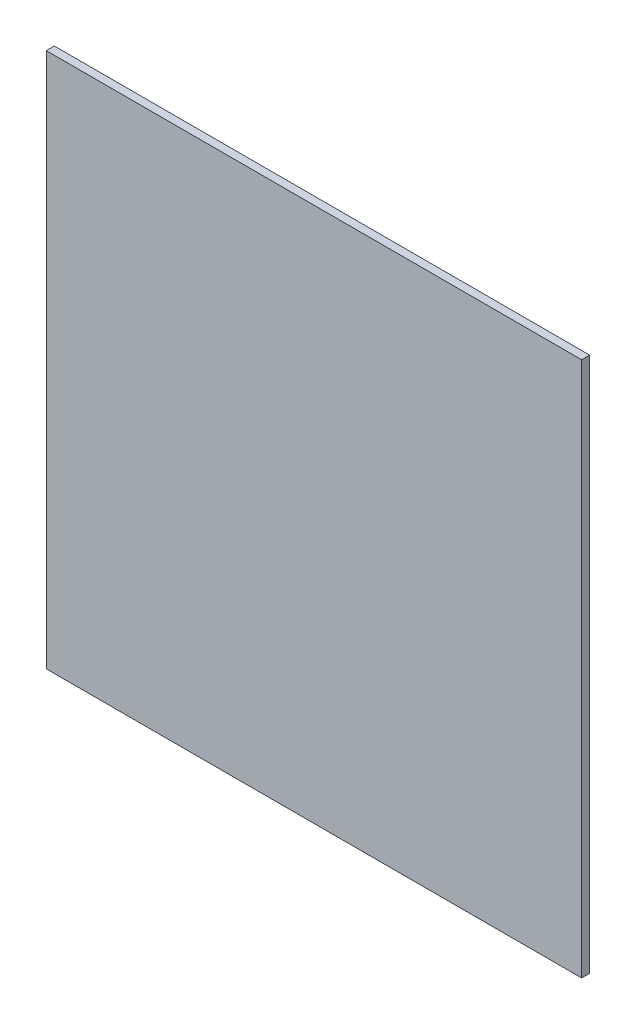
from build123d import *

# Parameters (mm, degrees)
ESBO_O1_W                = 200
ESBO_O1_H                = 200
RESSALTO_EXTRUS_O1_DEPTH = 3


with BuildPart() as part:
    # Esboço1 → Ressalto-extrusão1 (new body)
    with BuildSketch(Plane.XY):
        Rectangle(ESBO_O1_W, ESBO_O1_H)
    extrude(amount=RESSALTO_EXTRUS_O1_DEPTH)


solid = part.part
